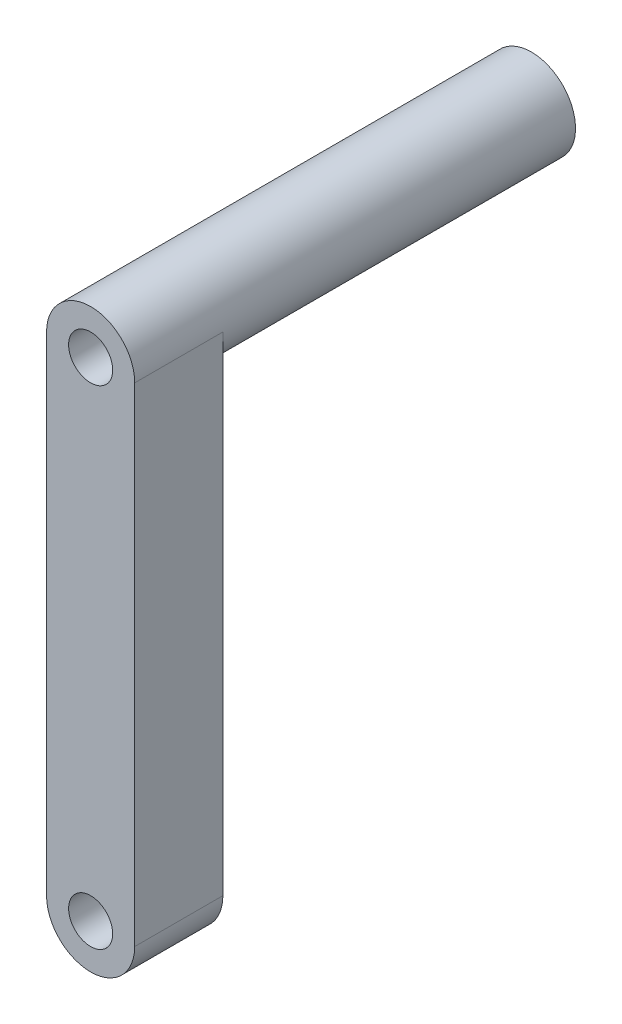
from build123d import *
from build123d.topology import SkipClean

# Parameters (mm, degrees)
SKETCH_1_R      = 0.5
EXTRUDE_1_DEPTH = 2
EXTRUDE_START   = 8
SKETCH_3_R      = 1
SKETCH_3_R_2    = 0.5
EXTRUDE_3_DEPTH = 8


with BuildPart() as part:
    # 草图1 → 凸台-拉伸1 (new body)
    with BuildSketch(Plane.XY):
        with BuildLine():
            Line((-1.092551508, -5.045535568), (-1.092551508, 6.029448207))
            ThreePointArc((-1.092551508, 6.029448207), (-0.092551508, 7.029448207), (0.907448492, 6.029448207))
            Line((0.907448492, 6.029448207), (0.907448492, -5.045535417))
            ThreePointArc((0.907448492, -5.045535417), (-0.092551432, -6.045535568), (-1.092551508, -5.045535568))
        make_face()
        with Locations((-0.092551508, -5.045535568)):
            Circle(SKETCH_1_R, mode=Mode.SUBTRACT)
        with Locations((-0.092551508, 6.029448207)):
            Circle(SKETCH_1_R, mode=Mode.SUBTRACT)
    extrude(amount=EXTRUDE_1_DEPTH)

    # 草图3 → 凸台-拉伸3 (add)
    with SkipClean():  # the faces are left unmerged after this step: merging them gives an invalid solid
        with BuildSketch(Plane(origin=(0, 0, 0), x_dir=(-1, 0, 0), z_dir=(0, 0, -1)).offset(EXTRUDE_START)):
            with Locations((0.092551508, 6.029448207)):
                Circle(SKETCH_3_R)
            with Locations((0.092551508, 6.029448207)):
                Circle(SKETCH_3_R_2, mode=Mode.SUBTRACT)
        extrude(amount=-EXTRUDE_3_DEPTH)


solid = part.part
